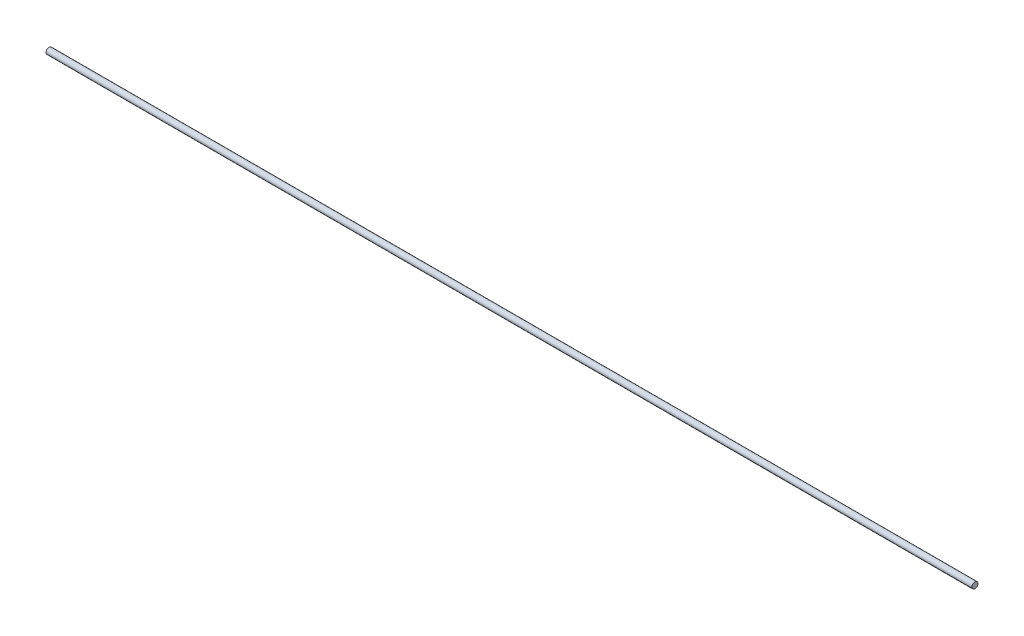
from build123d import *

# Parameters (mm, degrees)
CROQUIS1_R              = 4
SALIENTE_EXTRUIR1_DEPTH = 607.815


with BuildPart() as part:
    # Croquis1 → Saliente-Extruir1 (new, symmetric)
    with BuildSketch(Plane(origin=(0, 0, 0), x_dir=(0, 0, -1), z_dir=(1, 0, 0))):
        Circle(CROQUIS1_R)
    extrude(amount=SALIENTE_EXTRUIR1_DEPTH, both=True)


solid = part.part
